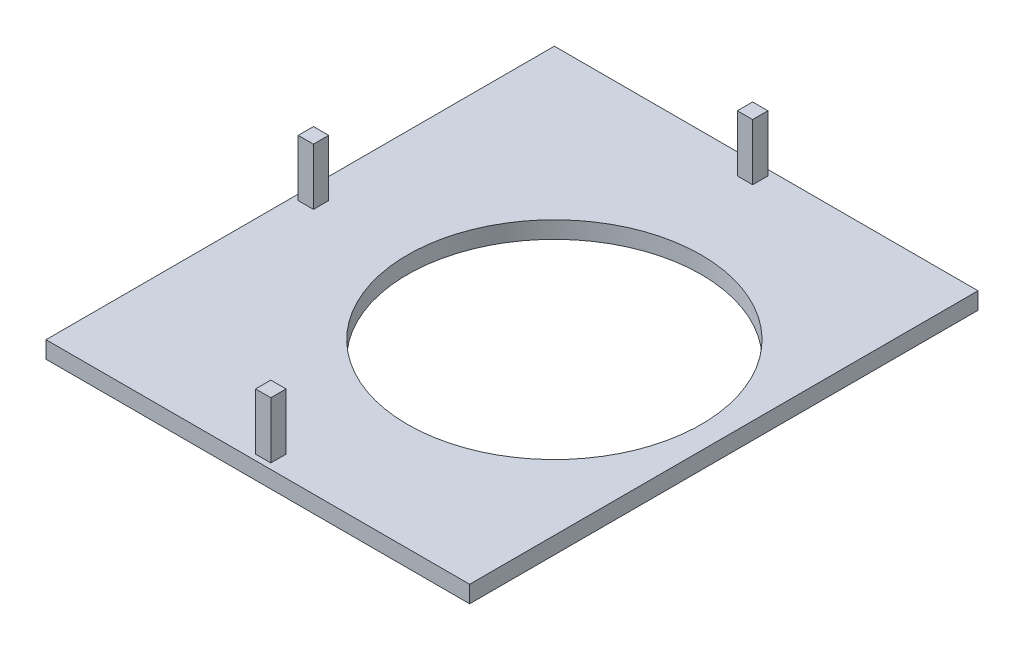
from build123d import *

# Parameters (mm, degrees)
SKETCH1_W           = 75
SKETCH1_H           = 90
BOSS_EXTRUDE1_DEPTH = 3
SKETCH2_W           = 2.7
SKETCH2_H           = 2.7
BOSS_EXTRUDE2_DEPTH = 10
SKETCH3_R           = 26
CUT_EXTRUDE1_DEPTH  = 3


with BuildPart() as part:
    # Sketch1 → Boss-Extrude1 (new body)
    with BuildSketch(Plane(origin=(0, 0, 0), x_dir=(1, 0, 0), z_dir=(0, 1, 0))):
        with Locations((37.5, -45)):
            Rectangle(SKETCH1_W, SKETCH1_H)
    extrude(amount=BOSS_EXTRUDE1_DEPTH)

    # Sketch2 → Boss-Extrude2 (add)
    with BuildSketch(Plane(origin=(0, 3, 0), x_dir=(1, 0, 0), z_dir=(0, 1, 0))):
        with Locations((37.45, -2.35)):
            Rectangle(SKETCH2_W, SKETCH2_H)
        with Locations((2.35, -45)):
            Rectangle(SKETCH2_W, SKETCH2_H)
        with Locations((37.45, -87.65)):
            Rectangle(SKETCH2_W, SKETCH2_H)
    extrude(amount=BOSS_EXTRUDE2_DEPTH)

    # Sketch3 → Cut-Extrude1 (cut)
    with BuildSketch(Plane(origin=(0, 3, 0), x_dir=(1, 0, 0), z_dir=(0, 1, 0))):
        with Locations(Location((45, -45, 0), (0, 0, 270))):
            Circle(SKETCH3_R)
    extrude(amount=-CUT_EXTRUDE1_DEPTH, mode=Mode.SUBTRACT)


solid = part.part
